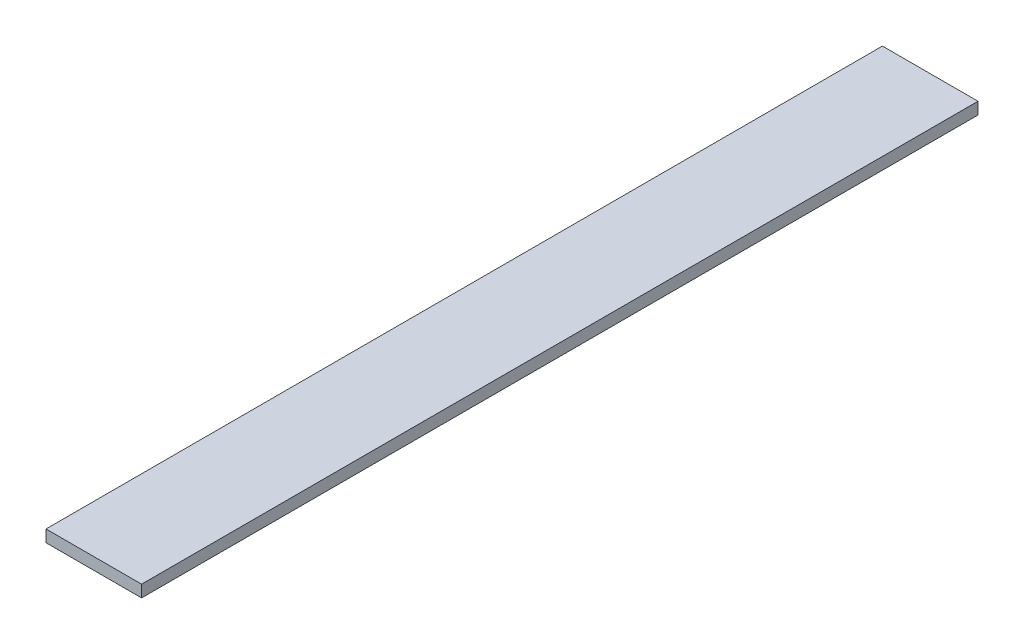
from build123d import *

# Parameters (mm, degrees)
SKETCH1_W           = 4
SKETCH1_H           = 0.5
BOSS_EXTRUDE1_DEPTH = 35


with BuildPart() as part:
    # Sketch1 → Boss-Extrude1 (new body)
    with BuildSketch(Plane.XY):
        with Locations((0, 5.25)):
            Rectangle(SKETCH1_W, SKETCH1_H)
    extrude(amount=-BOSS_EXTRUDE1_DEPTH)


solid = part.part
